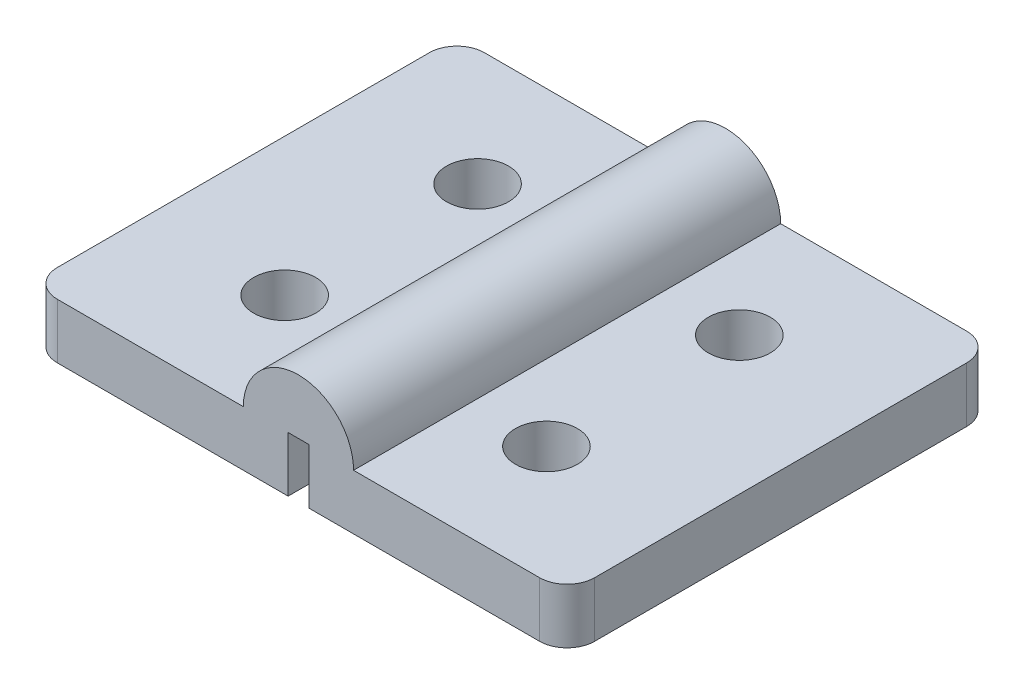
from build123d import *

# Parameters (mm, degrees)
CROQUIS1_W              = 39
CROQUIS1_H              = 31
CROQUIS1_R              = 2.25
SALIENTE_EXTRUIR1_DEPTH = 4
CROQUIS2_R              = 4
SALIENTE_EXTRUIR2_DEPTH = 31
CROQUIS3_W              = 1.5
CROQUIS3_H              = 4
CORTAR_EXTRUIR1_DEPTH   = 31
REDONDEO1_R             = 2


with BuildPart() as part:
    # Croquis1 → Saliente-Extruir1 (new body)
    with BuildSketch(Plane(origin=(0, 0, 0), x_dir=(1, 0, 0), z_dir=(0, 1, 0))):
        with Locations((19.5, 15.5)):
            Rectangle(CROQUIS1_W, CROQUIS1_H)
        with Locations(Location((10, 22.5, 0), (0, 0, 270))):
            Circle(CROQUIS1_R, mode=Mode.SUBTRACT)
        with Locations(Location((29, 22.5, 0), (0, 0, 270))):
            Circle(CROQUIS1_R, mode=Mode.SUBTRACT)
        with Locations(Location((29, 8.5, 0), (0, 0, 270))):
            Circle(CROQUIS1_R, mode=Mode.SUBTRACT)
        with Locations(Location((10, 8.5, 0), (0, 0, 270))):
            Circle(CROQUIS1_R, mode=Mode.SUBTRACT)
    extrude(amount=SALIENTE_EXTRUIR1_DEPTH)

    # Croquis2 → Saliente-Extruir2 (add)
    with BuildSketch(Plane.XY):
        with Locations((19.5, 4)):
            Circle(CROQUIS2_R)
    extrude(amount=-SALIENTE_EXTRUIR2_DEPTH)

    # Croquis3 → Cortar-Extruir1 (cut)
    with BuildSketch(Plane(origin=(0, 0, -31), x_dir=(-1, 0, 0), z_dir=(0, 0, -1))):
        with Locations((-19.5, 2)):
            Rectangle(CROQUIS3_W, CROQUIS3_H)
    extrude(amount=-CORTAR_EXTRUIR1_DEPTH, mode=Mode.SUBTRACT)

    # Redondeo1
    redondeo1_edges = [part.edges().sort_by_distance(p)[0] for p in [
        (0, 2, -31),
        (39, 2, -31),
        (39, 2, 0),
        (0, 2, 0),
    ]]
    fillet(redondeo1_edges, radius=REDONDEO1_R)


solid = part.part
